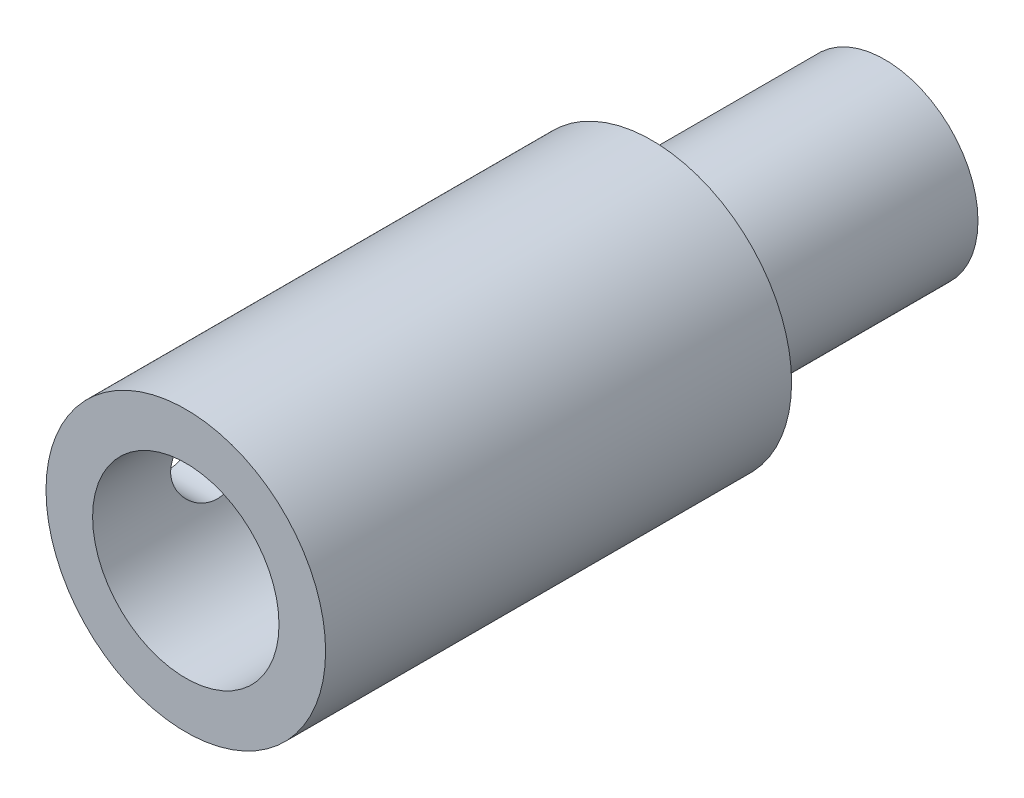
from build123d import *

# Parameters (mm, degrees)
BOSS_EXTRUDE1_START     = -15.24
BOSS_EXTRUDE1_DEPTH     = 12.192
CUT_EXTRUDE4_DEPTH      = 6.35
CUT_EXTRUDE4_DEPTH_BACK = 8.89
SKETCH4_R               = 2.0955


with BuildPart() as part:
    # Sketch1 → Revolve1 (revolve)
    with BuildSketch(Plane(origin=(0, 0, 0), x_dir=(1, 0, 0), z_dir=(0, 1, 0))):
        Polygon((2.54, 6.35), (2.54, -6.35), (2.54, -8.89), (5.08, -8.89), (5.08, -31.75), (7.62, -31.75), (7.62, -6.35), (5.08, -6.35), (5.08, 6.35), align=None)
    revolve(axis=Axis((0, 0, 6.35), (0, 0, -1)))

    # Sketch2 → Boss-Extrude1 (add)
    with BuildSketch(Plane(origin=(0, 0, -6.35), x_dir=(-1, 0, 0), z_dir=(0, 0, -1)).offset(BOSS_EXTRUDE1_START)):
        with BuildLine():
            Line((1.651, -1.930232888), (1.651, 1.930232888))
            ThreePointArc((1.651, 1.930232888), (2.54, 0), (1.651, -1.930232888))
        make_face()
        with BuildLine():
            Line((-1.651, -1.930232888), (-1.651, 1.930232888))
            ThreePointArc((-1.651, 1.930232888), (-2.54, 0), (-1.651, -1.930232888))
        make_face()
    extrude(amount=BOSS_EXTRUDE1_DEPTH)

    # Sketch4 → Cut-Extrude4 (cut, two sides: drawn at the far end of the back side and taken through both)
    with BuildSketch(Plane(origin=(0, 0, 0), x_dir=(0, 0, -1), z_dir=(1, 0, 0)).offset(-CUT_EXTRUDE4_DEPTH_BACK)):
        with Locations(Location((-25.4, 0, 0), (0, 0, 180))):
            Circle(SKETCH4_R)
    extrude(amount=CUT_EXTRUDE4_DEPTH + CUT_EXTRUDE4_DEPTH_BACK, mode=Mode.SUBTRACT)


solid = part.part
